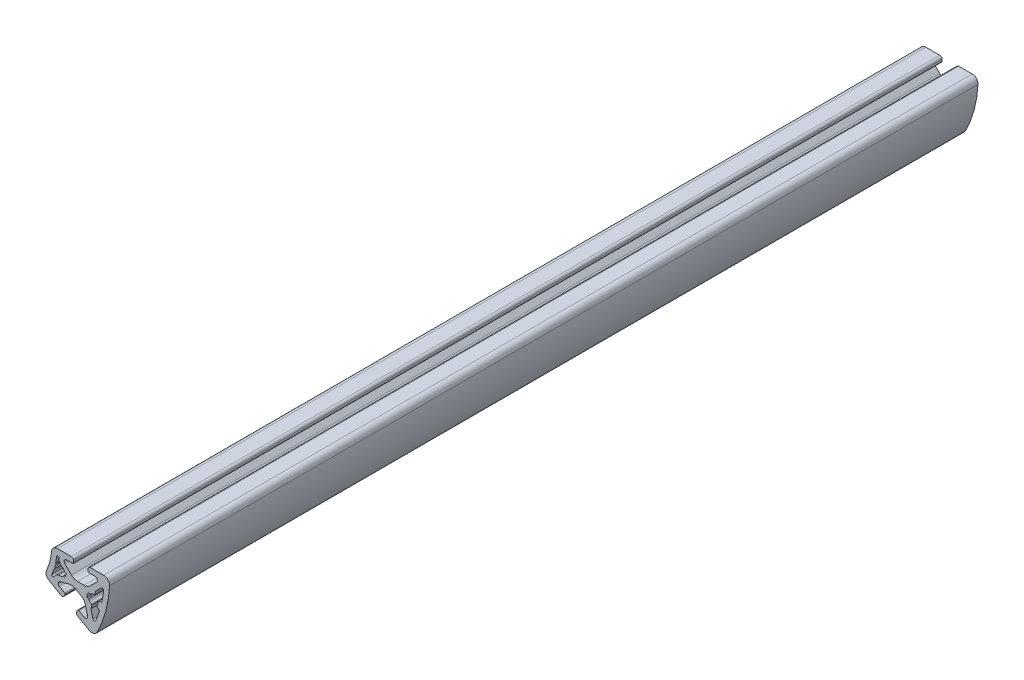
from build123d import *

# Parameters (mm, degrees)
BOSS_EXTRU_1_DEPTH = 300


with BuildPart() as part:
    # Esquisse1 → Boss.-Extru.1 (new body)
    with BuildSketch(Plane.XY):
        with BuildLine():
            Line((-2.277781394, 7.764570671), (-7.068879094, 7.764570671))
            ThreePointArc((-7.068879094, 7.764570671), (-8.417278819, 7.241668562), (-9.060597485, 5.946388851))
            ThreePointArc((-9.060597485, 5.946388851), (-9.659264868, 2.58818977), (-10.819903246, -0.619429637))
            ThreePointArc((-10.819903246, -0.619429637), (-10.910412794, -2.062834106), (-10.00411543, -3.18988048))
            Line((-10.00411543, -3.18988048), (-5.834093414, -5.597443814))
            ThreePointArc((-5.834093414, -5.597443814), (-5.236709364, -5.662062276), (-4.7628449, -5.292609007))
            Line((-4.7628449, -5.292609007), (-4.412844891, -4.68639123))
            ThreePointArc((-4.412844891, -4.68639123), (-4.382874764, -4.458745516), (-4.522652512, -4.276583608))
            Line((-4.522652512, -4.276583608), (-6.356537861, -3.217789408))
            ThreePointArc((-6.356537861, -3.217789408), (-6.765622267, -2.388248296), (-6.155776036, -1.692851946))
            Line((-6.155776036, -1.692851946), (-3.081802459, -0.869183204))
            ThreePointArc((-3.081802459, -0.869183204), (-1.913766747, -0.792626099), (-0.805345324, -1.168884471))
            Line((-0.805345324, -1.168884471), (1.159782546, -2.303451576))
            ThreePointArc((1.159782546, -2.303451576), (2.039842566, -3.075243499), (2.557560023, -4.125070649))
            Line((2.557560023, -4.125070649), (3.381228766, -7.199044225))
            ThreePointArc((3.381228766, -7.199044225), (3.083920975, -8.074884735), (2.160975089, -8.135377804))
            Line((2.160975089, -8.135377804), (0.32708974, -7.076583604))
            ThreePointArc((0.32708974, -7.076583604), (0.099444026, -7.046613477), (-0.082717881, -7.186391225))
            Line((-0.082717881, -7.186391225), (-0.432717881, -7.792609008))
            ThreePointArc((-0.432717881, -7.792609008), (-0.515741566, -8.3877143), (-0.161088322, -8.872754831))
            Line((-0.161088322, -8.872754831), (3.885572059, -11.209095291))
            ThreePointArc((3.885572059, -11.209095291), (5.453886583, -11.394599855), (6.667853821, -10.384497912))
            ThreePointArc((6.667853821, -10.384497912), (9.659251661, -2.588191136), (10.966778527, 5.659307508))
            ThreePointArc((10.966778527, 5.659307508), (10.420503025, 7.141065072), (8.969550516, 7.764570662))
            Line((8.969550516, 7.764570662), (4.322218596, 7.764570662))
            ThreePointArc((4.322218596, 7.764570662), (3.756533171, 7.530256087), (3.522218596, 6.964570662))
            Line((3.522218596, 6.964570662), (3.522218596, 6.264570662))
            ThreePointArc((3.522218596, 6.264570662), (3.610086561, 6.052438628), (3.822218596, 5.964570662))
            Line((3.822218596, 5.964570662), (5.939806996, 5.964570662))
            ThreePointArc((5.939806996, 5.964570662), (6.708855039, 5.450709188), (6.528410886, 4.543555168))
            Line((6.528410886, 4.543555168), (4.278106046, 2.293250328))
            ThreePointArc((4.278106046, 2.293250328), (3.304835999, 1.642932074), (2.156785702, 1.414570672))
            Line((2.156785702, 1.414570672), (-0.112348508, 1.414570672))
            ThreePointArc((-0.112348508, 1.414570672), (-1.260398803, 1.642932074), (-2.233668848, 2.293250327))
            Line((-2.233668848, 2.293250327), (-4.483973688, 4.543555167))
            ThreePointArc((-4.483973688, 4.543555167), (-4.664417843, 5.450709193), (-3.895369794, 5.964570671))
            Line((-3.895369794, 5.964570671), (-1.777781394, 5.964570671))
            ThreePointArc((-1.777781394, 5.964570671), (-1.565649359, 6.052438637), (-1.477781394, 6.264570671))
            Line((-1.477781394, 6.264570671), (-1.477781394, 6.964570671))
            ThreePointArc((-1.477781394, 6.964570671), (-1.712095969, 7.530256096), (-2.277781394, 7.764570671))
        make_face()
        with BuildLine():
            Line((-7.323961592, 5.240984459), (-7.661560194, 3.19617001))
            ThreePointArc((-7.661560194, 3.19617001), (-7.657816372, 3.097611471), (-7.607424532, 3.012826659))
            Line((-7.607424532, 3.012826659), (-7.57849861, 2.983900741))
            ThreePointArc((-7.57849861, 2.983900741), (-7.520213219, 2.853306067), (-7.56403866, 2.717175664))
            ThreePointArc((-7.56403866, 2.717175664), (-7.87179554, 2.110471478), (-7.908622362, 1.431171801))
            ThreePointArc((-7.908622362, 1.431171801), (-7.938733618, 1.291366699), (-8.05450758, 1.20741109))
            Line((-8.05450758, 1.20741109), (-8.094021121, 1.196823472))
            ThreePointArc((-8.094021121, 1.196823472), (-8.180054139, 1.148593589), (-8.23257565, 1.0651113))
            Line((-8.23257565, 1.0651113), (-8.962613913, -0.874549263))
            ThreePointArc((-8.962613913, -0.874549263), (-8.771314591, -1.392312789), (-8.244983453, -1.226029799))
            ThreePointArc((-8.244983453, -1.226029799), (-7.559869341, -0.421536961), (-6.6135889, 0.048721903))
            ThreePointArc((-6.6135889, 0.048721903), (-6.572819287, 0.055124525), (-6.531603527, 0.053023068))
            ThreePointArc((-6.531603527, 0.053023068), (-5.816110839, 0.099392966), (-5.18783842, 0.444869046))
            ThreePointArc((-5.18783842, 0.444869046), (-5.101288158, 0.489475582), (-5.003931638, 0.487926814))
            Line((-5.003931638, 0.487926814), (-4.707356797, 0.408459826))
            ThreePointArc((-4.707356797, 0.408459826), (-4.585051414, 0.414498293), (-4.489190426, 0.490693704))
            ThreePointArc((-4.489190426, 0.490693704), (-4.201277401, 1.126959114), (-4.132484687, 1.821937635))
            ThreePointArc((-4.132484687, 1.821937635), (-4.177405034, 1.935855289), (-4.280305369, 2.002237445))
            Line((-4.280305369, 2.002237445), (-4.576880211, 2.081704429))
            ThreePointArc((-4.576880211, 2.081704429), (-4.661967815, 2.129041419), (-4.714619271, 2.210946946))
            ThreePointArc((-4.714619271, 2.210946946), (-5.085981109, 2.82427422), (-5.682431007, 3.222178075))
            ThreePointArc((-5.682431007, 3.222178075), (-5.719175628, 3.240966039), (-5.751281836, 3.266895679))
            ThreePointArc((-5.751281836, 3.266895679), (-6.335655302, 4.147292021), (-6.526735107, 5.186560309))
            ThreePointArc((-6.526735107, 5.186560309), (-6.899409756, 5.593731171), (-7.323961592, 5.240984459))
        make_face(mode=Mode.SUBTRACT)
        with BuildLine():
            Line((4.039005672, -0.226915238), (3.742430831, -0.147448251))
            ThreePointArc((3.742430831, -0.147448251), (3.620125447, -0.153486718), (3.524264457, -0.22968213))
            ThreePointArc((3.524264457, -0.22968213), (3.236351435, -0.865947537), (3.167558721, -1.560926054))
            ThreePointArc((3.167558721, -1.560926054), (3.212479068, -1.674843705), (3.3153794, -1.74122586))
            Line((3.3153794, -1.74122586), (3.611954241, -1.820692845))
            ThreePointArc((3.611954241, -1.820692845), (3.697041845, -1.868029834), (3.749693301, -1.949935361))
            ThreePointArc((3.749693301, -1.949935361), (4.120587374, -2.562773684), (4.716243148, -2.960677472))
            ThreePointArc((4.716243148, -2.960677472), (4.822262289, -3.056657136), (4.837082998, -3.198898132))
            Line((4.837082998, -3.198898132), (4.519637838, -4.383619602))
            ThreePointArc((4.519637838, -4.383619602), (4.512823004, -4.435383412), (4.519637838, -4.487147222))
            Line((4.519637838, -4.487147222), (5.227723978, -7.129760649))
            ThreePointArc((5.227723978, -7.129760649), (5.675553803, -7.499115267), (6.170739428, -7.196186922))
            Line((6.170739428, -7.196186922), (7.455923223, -3.717453783))
            ThreePointArc((7.455923223, -3.717453783), (7.459439401, -3.609785311), (7.406594848, -3.515911372))
            Line((7.406594848, -3.515911372), (6.613572648, -2.722889172))
            ThreePointArc((6.613572648, -2.722889172), (6.555287263, -2.592294501), (6.599112704, -2.456164105))
            ThreePointArc((6.599112704, -2.456164105), (6.906869584, -1.849459918), (6.943696406, -1.170160238))
            ThreePointArc((6.943696406, -1.170160238), (6.973807663, -1.030355137), (7.089581623, -0.946399529))
            Line((7.089581623, -0.946399529), (8.172870105, -0.656133266))
            ThreePointArc((8.172870105, -0.656133266), (8.2655718, -0.601258323), (8.316360933, -0.506256599))
            Line((8.316360933, -0.506256599), (8.942725678, 3.149006571))
            ThreePointArc((8.942725678, 3.149006571), (8.665346523, 3.658943048), (8.092837193, 3.56298747))
            Line((8.092837193, 3.56298747), (6.158309903, 1.62846018))
            ThreePointArc((6.158309903, 1.62846018), (6.126526177, 1.587038823), (6.106546092, 1.53880263))
            Line((6.106546092, 1.53880263), (5.789100936, 0.35408116))
            ThreePointArc((5.789100936, 0.35408116), (5.705145325, 0.238307201), (5.565340223, 0.208195951))
            ThreePointArc((5.565340223, 0.208195951), (4.850535301, 0.161429048), (4.222912453, -0.18385747))
            ThreePointArc((4.222912453, -0.18385747), (4.136362192, -0.228464006), (4.039005672, -0.226915238))
        make_face(mode=Mode.SUBTRACT)
    extrude(amount=BOSS_EXTRU_1_DEPTH)


solid = part.part
